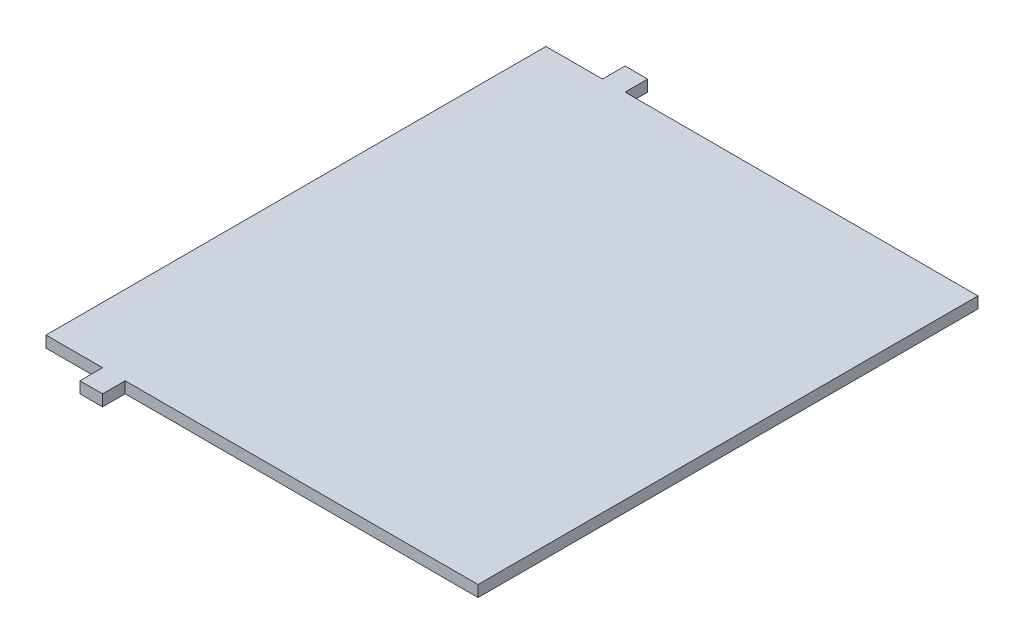
from build123d import *

# Parameters (mm, degrees)
SKETCH1_W           = 191
SKETCH1_H           = 221
BOSS_EXTRUDE1_DEPTH = 5
SKETCH2_W           = 10
SKETCH2_H           = 241
BOSS_EXTRUDE2_DEPTH = 5


with BuildPart() as part:
    # Sketch1 → Boss-Extrude1 (new body)
    with BuildSketch(Plane(origin=(0, 0, 0), x_dir=(1, 0, 0), z_dir=(0, 1, 0))):
        Rectangle(SKETCH1_W, SKETCH1_H)
    extrude(amount=BOSS_EXTRUDE1_DEPTH)

    # Sketch2 → Boss-Extrude2 (add)
    with BuildSketch(Plane(origin=(0, 5, 0), x_dir=(1, 0, 0), z_dir=(0, 1, 0))):
        with Locations((-65.5, 0)):
            Rectangle(SKETCH2_W, SKETCH2_H)
    extrude(amount=-BOSS_EXTRUDE2_DEPTH)


solid = part.part
